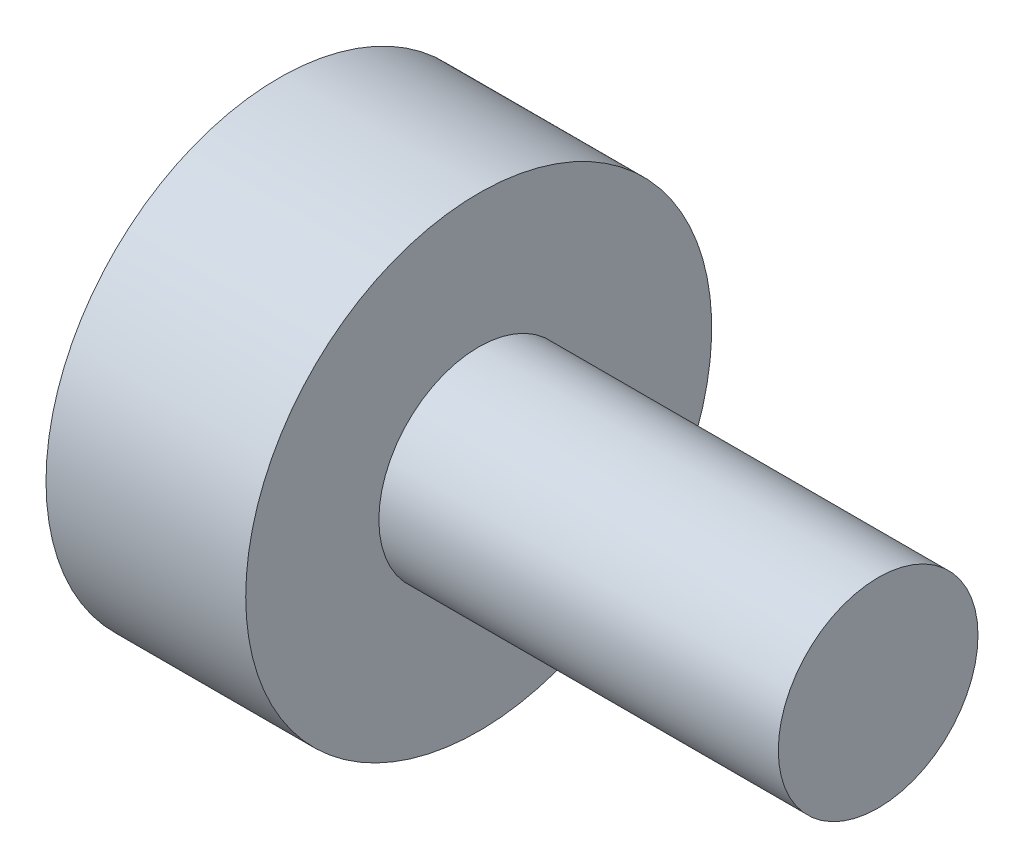
from build123d import *

# Parameters (mm, degrees)
SKETCH_2_R          = 4.25
CUT_EXTRUDE_1_DEPTH = 20


with BuildPart() as part:
    # Эскиз1 → Повернуть1 (revolve)
    with BuildSketch(Plane.XY, mode=Mode.PRIVATE) as revolve_1_sk:
        Polygon((0, 0), (100, 0), (100, 15), (40, 15), (40, 35), (10, 35), (10, 20), (0, 20), align=None)
    revolve(revolve_1_sk.sketch.rotate(Axis((0, 0, 0), (1, 0, 0)), 90), axis=Axis((0, 0, 0), (1, 0, 0)))

    # Эскиз2 → Вырез-Вытянуть1 (cut)
    with BuildSketch(Plane(origin=(0, 0, 0), x_dir=(0, 0, -1), z_dir=(1, 0, 0))):
        Circle(SKETCH_2_R)
    extrude(amount=CUT_EXTRUDE_1_DEPTH, mode=Mode.SUBTRACT)


solid = part.part
